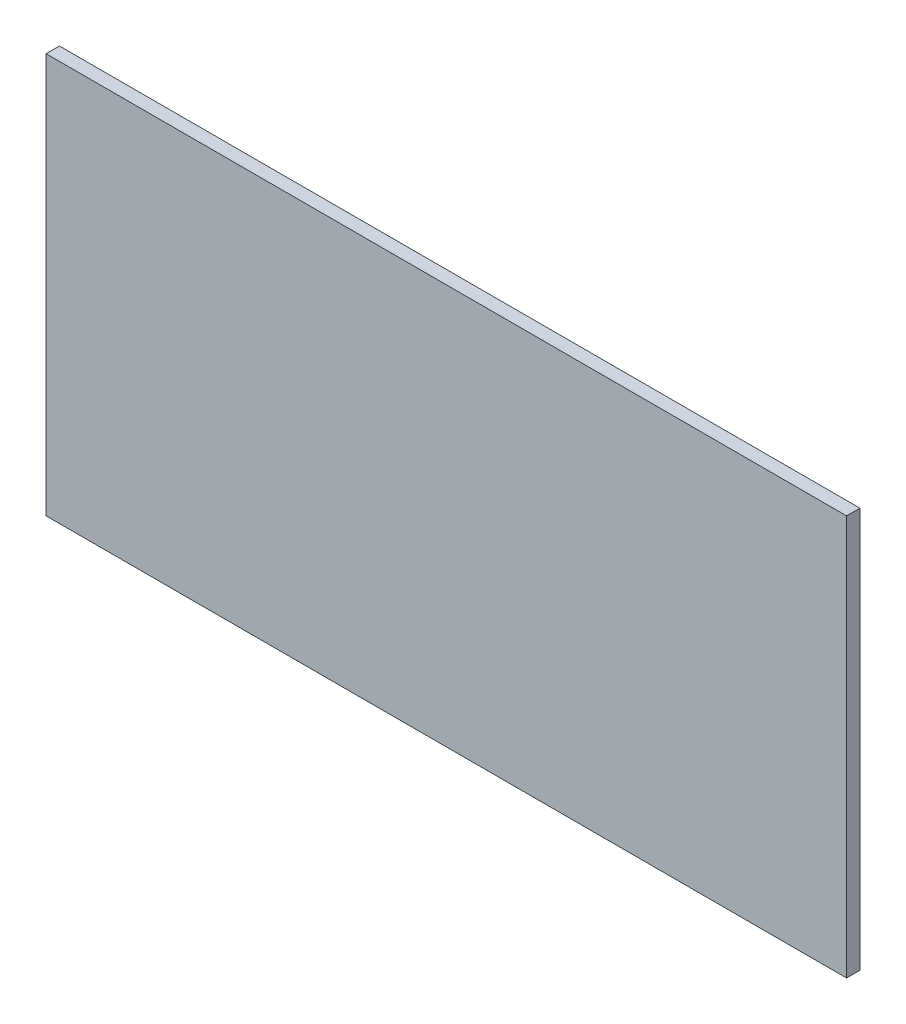
from build123d import *

# Parameters (mm, degrees)
SKETCH1_W           = 120
SKETCH1_H           = 60
BOSS_EXTRUDE1_DEPTH = 2


with BuildPart() as part:
    # Sketch1 → Boss-Extrude1 (new body)
    with BuildSketch(Plane(origin=(0, 0, -90), x_dir=(-1, 0, 0), z_dir=(0, 0, -1))):
        with Locations((0, 30)):
            Rectangle(SKETCH1_W, SKETCH1_H)
    extrude(amount=BOSS_EXTRUDE1_DEPTH)


solid = part.part
